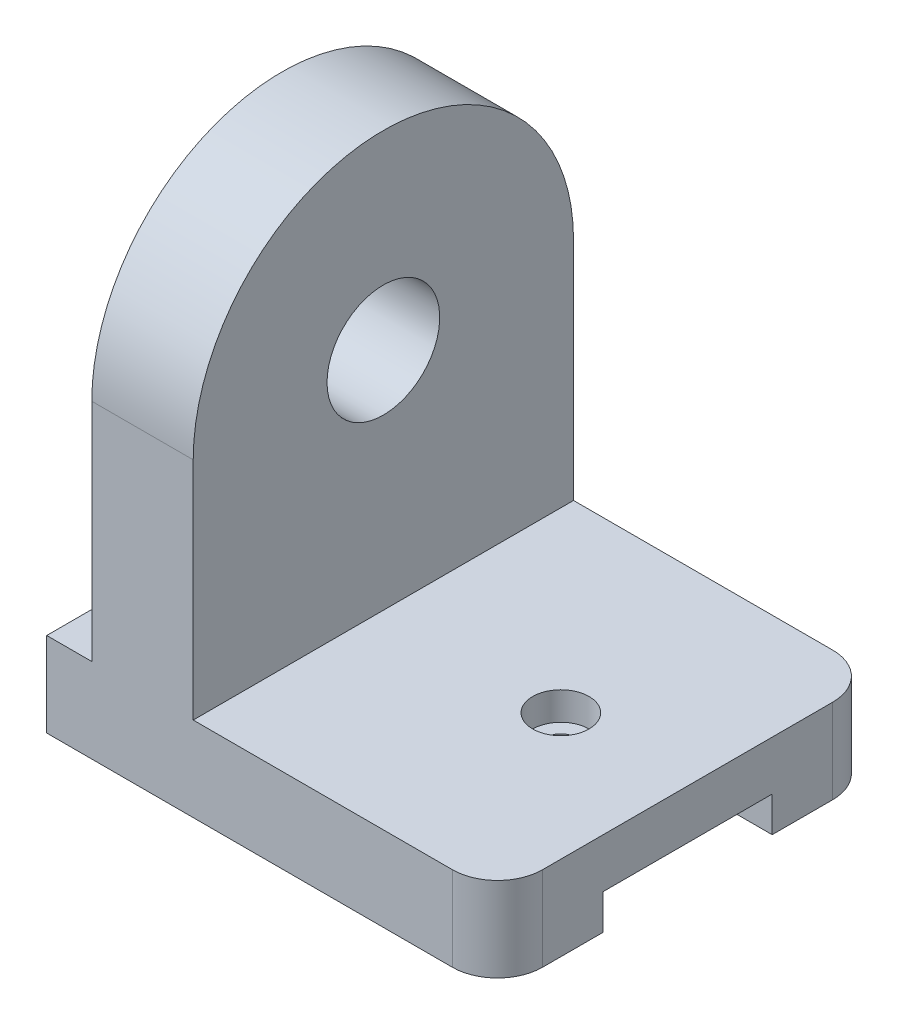
from build123d import *

# Parameters (mm, degrees)
EXTRUDE_1_DEPTH           = 60
CUT_EXTRUDE_1_DEPTH       = 423.965719651
CUT_EXTRUDE_1_DEPTH_BACK  = 25
HOLE_WIZARD_1_D           = 20
HOLE_WIZARD_1_CBORE_D     = 40
HOLE_WIZARD_1_CBORE_DEPTH = 20
EXTRUDE_START             = -32
EXTRUDE_3_DEPTH           = 72
CUT_EXTRUDE_3_DEPTH       = 531.913363931
CUT_EXTRUDE_3_DEPTH_BACK  = 531.913363931
SKETCH_10_R               = 40
SKETCH_12_R               = 80
CUT_EXTRUDE_5_DEPTH       = 20


with BuildPart() as part:
    # 草图1 → 凸台-拉伸1 (new body)
    with BuildSketch(Plane(origin=(0, 0, 0), x_dir=(1, 0, 0), z_dir=(0, 1, 0))):
        with BuildLine():
            Line((0, 0), (288, 0))
            ThreePointArc((288, 0), (310.627416998, -9.372583002), (320, -32))
            Line((320, -32), (320, -238))
            ThreePointArc((320, -238), (310.627416998, -260.627416998), (288, -270))
            Line((288, -270), (0, -270))
            Line((0, -270), (0, 0))
        make_face()
    extrude(amount=EXTRUDE_1_DEPTH)

    # 草图2 → 切除-拉伸1 (cut, two sides: drawn at the far end of the back side and taken through both)
    with BuildSketch(Plane.XZ.offset(-CUT_EXTRUDE_1_DEPTH_BACK)):
        with BuildLine():
            Line((230, 195), (320, 195))
            Line((320, 195), (320, 75))
            Line((320, 75), (230, 75))
            ThreePointArc((230, 75), (170, 135), (230, 195))
        make_face()
    extrude(amount=CUT_EXTRUDE_1_DEPTH + CUT_EXTRUDE_1_DEPTH_BACK, mode=Mode.SUBTRACT)

    # 孔1 (through all)
    with Locations(Plane(origin=(0, 60, 0), x_dir=(1, 0, 0), z_dir=(0, 1, 0))):
        with Locations((230, -135)):
            CounterBoreHole(HOLE_WIZARD_1_D / 2, HOLE_WIZARD_1_CBORE_D / 2, HOLE_WIZARD_1_CBORE_DEPTH)

    # 草图8 → 凸台-拉伸3 (add)
    with BuildSketch(Plane.ZY.offset(EXTRUDE_START)):
        with BuildLine():
            Line((0, 60), (270, 60))
            Line((270, 60), (270, 220))
            ThreePointArc((270, 220), (135, 355), (0, 220))
            Line((0, 220), (0, 60))
        make_face()
    extrude(amount=-EXTRUDE_3_DEPTH)

    # 草图10 → 切除-拉伸3 (cut, two sides: drawn at the far end of the back side and taken through both)
    with BuildSketch(Plane.ZY.offset(-32).offset(-CUT_EXTRUDE_3_DEPTH_BACK)):
        with Locations((135, 220)):
            Circle(SKETCH_10_R)
    extrude(amount=CUT_EXTRUDE_3_DEPTH + CUT_EXTRUDE_3_DEPTH_BACK, mode=Mode.SUBTRACT)

    # 草图12 → 切除-拉伸5 (cut)
    with BuildSketch(Plane.ZY.offset(-32)):
        with BuildLine():
            Line((255, 60), (255, 220))
            ThreePointArc((255, 220), (135, 340), (15, 220))
            Line((15, 220), (15, 60))
            Line((15, 60), (255, 60))
        make_face()
        with Locations((135, 220)):
            Circle(SKETCH_12_R, mode=Mode.SUBTRACT)
    extrude(amount=-CUT_EXTRUDE_5_DEPTH, mode=Mode.SUBTRACT)


solid = part.part
